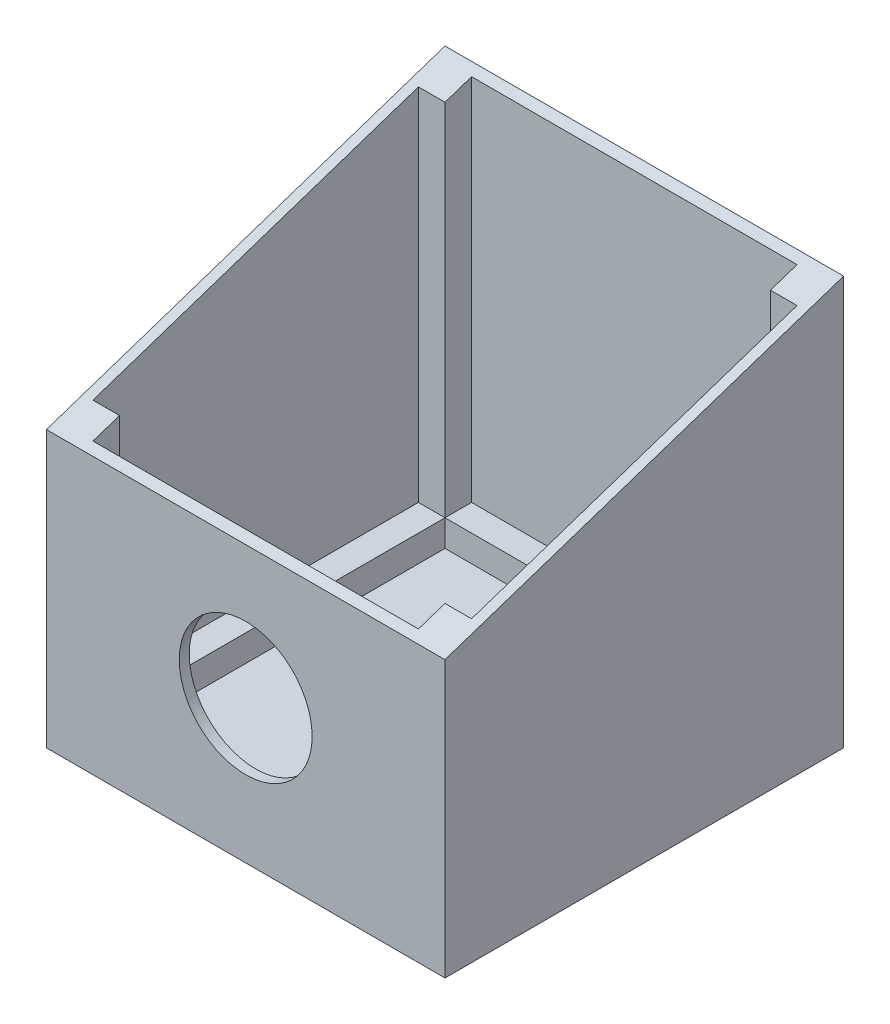
from build123d import *

# Parameters (mm, degrees)
CROQUIS1_W                 = 120
CROQUIS1_H                 = 120
SALIENTE_EXTRUIR1_DEPTH    = 120
CORTAR_EXTRUIR1_DEPTH      = 120
CORTAR_EXTRUIR1_DEPTH_BACK = 120
CROQUIS3_R                 = 20
CORTAR_EXTRUIR2_DEPTH      = 120
CROQUIS4_W                 = 120
CROQUIS4_H                 = 120
SALIENTE_EXTRUIR2_DEPTH    = 3
CROQUIS4_3_W               = 98
CROQUIS4_3_H               = 8
CROQUIS4_3_W_2             = 8
CROQUIS4_3_H_2             = 98
SALIENTE_EXTRUIR3_DEPTH    = 8


with BuildPart() as part:
    # Croquis1 → Saliente-Extruir1 (new body)
    with BuildSketch(Plane(origin=(0, 0, 0), x_dir=(1, 0, 0), z_dir=(0, 1, 0))):
        with Locations((57, 57)):
            Rectangle(CROQUIS1_W, CROQUIS1_H)
        Polygon((8, 0), (106, 0), (106, 8), (114, 8), (114, 106), (106, 106), (106, 114), (8, 114), (8, 106), (0, 106), (0, 8), (8, 8), align=None, mode=Mode.SUBTRACT)
    extrude(amount=SALIENTE_EXTRUIR1_DEPTH)

    # Croquis2 → Cortar-Extruir1 (cut, two sides: drawn at the far end of the back side and taken through both)
    with BuildSketch(Plane(origin=(0, 0, 0), x_dir=(0, 0, -1), z_dir=(1, 0, 0)).offset(-CORTAR_EXTRUIR1_DEPTH_BACK)):
        Polygon((117, 120), (-3, 80), (-3, 120), align=None)
    extrude(amount=CORTAR_EXTRUIR1_DEPTH + CORTAR_EXTRUIR1_DEPTH_BACK, mode=Mode.SUBTRACT)

    # Croquis3 → Cortar-Extruir2 (cut)
    with BuildSketch(Plane.XY):
        with Locations((57, 40)):
            Circle(CROQUIS3_R)
    extrude(amount=CORTAR_EXTRUIR2_DEPTH, mode=Mode.SUBTRACT)

    # Croquis4 → Saliente-Extruir2 (add)
    with BuildSketch(Plane(origin=(0, 0, 0), x_dir=(1, 0, 0), z_dir=(0, 1, 0))):
        with Locations((57, 57)):
            Rectangle(CROQUIS4_W, CROQUIS4_H)
    extrude(amount=-SALIENTE_EXTRUIR2_DEPTH)

    # Croquis4<3> → Saliente-Extruir3 (add)
    with BuildSketch(Plane(origin=(0, 0, 0), x_dir=(1, 0, 0), z_dir=(0, 1, 0))):
        with Locations((57, 110)):
            Rectangle(CROQUIS4_3_W, CROQUIS4_3_H)
        with Locations((4, 57)):
            Rectangle(CROQUIS4_3_W_2, CROQUIS4_3_H_2)
        with Locations((57, 4)):
            Rectangle(CROQUIS4_3_W, CROQUIS4_3_H)
        with Locations((110, 57)):
            Rectangle(CROQUIS4_3_W_2, CROQUIS4_3_H_2)
    extrude(amount=SALIENTE_EXTRUIR3_DEPTH)


solid = part.part
